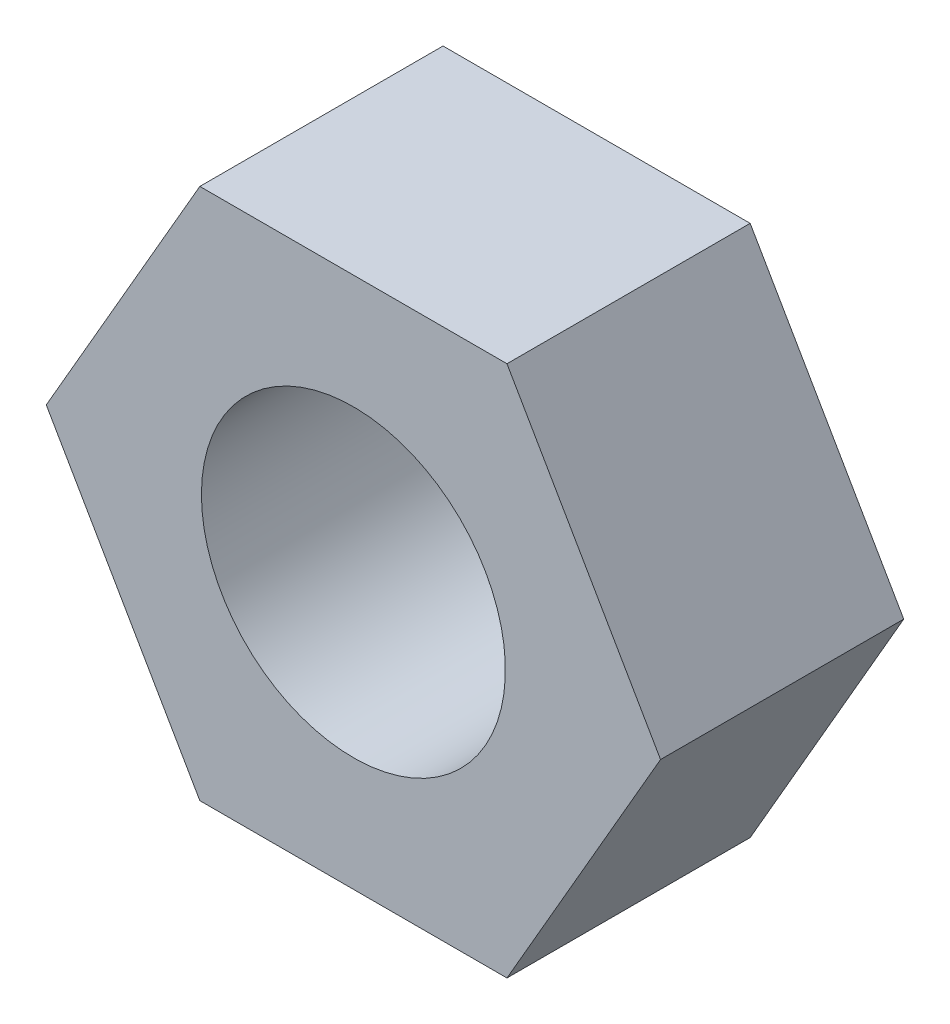
from build123d import *

# Parameters (mm, degrees)
BOSS_EXTRUDE1_DEPTH = 3.2
SKETCH3_R           = 2
CUT_EXTRUDE1_DEPTH  = 3.2


with BuildPart() as part:
    # Sketch2 → Boss-Extrude1 (new body)
    with BuildSketch(Plane.XY):
        Polygon((4.041451884, 0), (2.020725942, 3.5), (-2.020725942, 3.5), (-4.041451884, 0), (-2.020725942, -3.5), (2.020725942, -3.5), align=None)
    extrude(amount=BOSS_EXTRUDE1_DEPTH)

    # Sketch3 → Cut-Extrude1 (cut)
    with BuildSketch(Plane(origin=(0, 0, 0), x_dir=(-1, 0, 0), z_dir=(0, 0, -1))):
        Circle(SKETCH3_R)
    extrude(amount=-CUT_EXTRUDE1_DEPTH, mode=Mode.SUBTRACT)


solid = part.part
